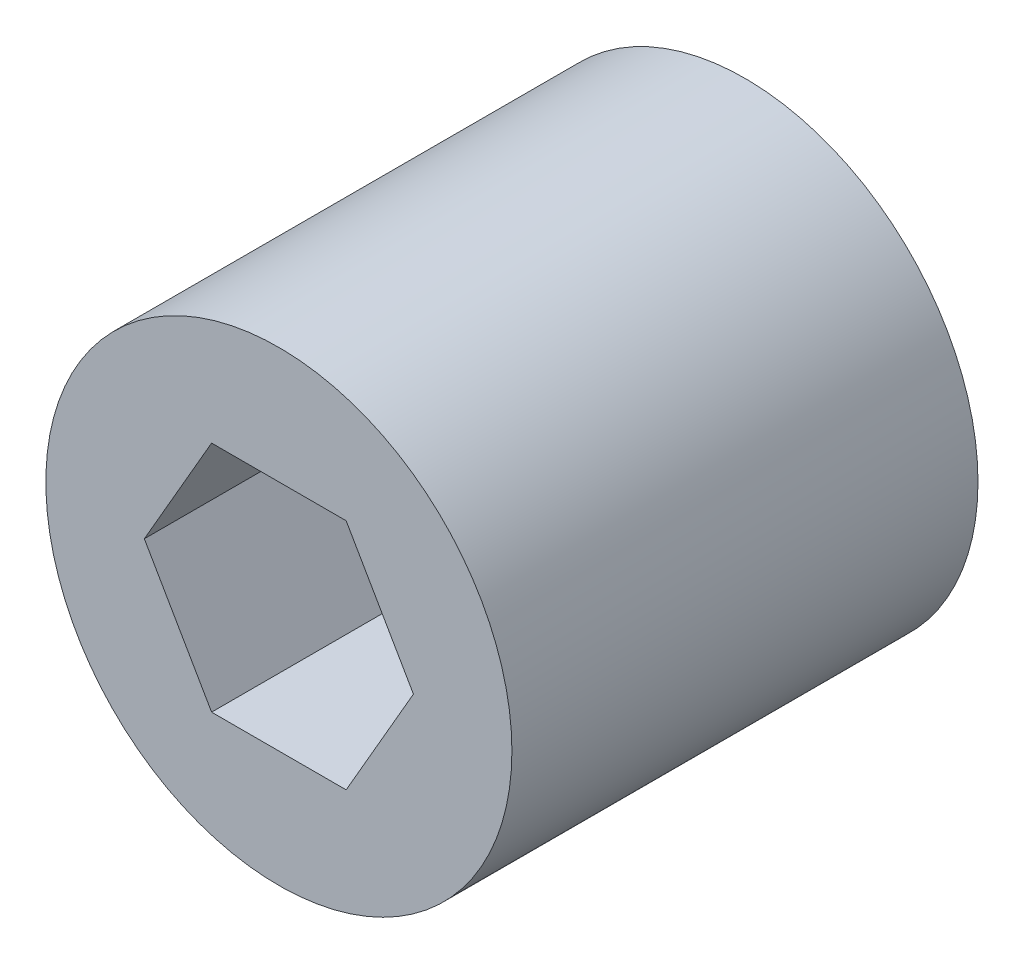
from build123d import *

# Parameters (mm, degrees)
S01_M3_HEADLESS_BODY_R                 = 1.5
F_01_M3_HEADLESS_BODY_DEPTH            = 4
F_02_START                             = 2.8
F_02_1_5_MM_HEX_SOCKET_DEPTH           = 1.3
THREE_START                            = 1
THREE_MILLIMETRE_SCREW_LENGTH_LAYOUT_R = 2
THREE_MILLIMETRE_SCREW_LENGTH_DEPTH    = 1.1


with BuildPart() as part:
    # S01 - M3 headless body → 01 - M3 headless body (new body)
    with BuildSketch(Plane.XY):
        Circle(S01_M3_HEADLESS_BODY_R)
    extrude(amount=F_01_M3_HEADLESS_BODY_DEPTH)

    # S02 - 1.5 mm hex socket → 02 - 1.5 mm hex socket (cut)
    with BuildSketch(Plane.XY.offset(F_02_START)):
        Polygon((0.866025404, 0), (0.433012702, 0.75), (-0.433012702, 0.75), (-0.866025404, 0), (-0.433012702, -0.75), (0.433012702, -0.75), align=None)
    extrude(amount=F_02_1_5_MM_HEX_SOCKET_DEPTH, mode=Mode.SUBTRACT)

    # Three millimetre screw length layout → Three millimetre screw length (cut)
    with BuildSketch(Plane.XY.offset(THREE_START)):
        Circle(THREE_MILLIMETRE_SCREW_LENGTH_LAYOUT_R)
    extrude(amount=-THREE_MILLIMETRE_SCREW_LENGTH_DEPTH, mode=Mode.SUBTRACT)


solid = part.part
